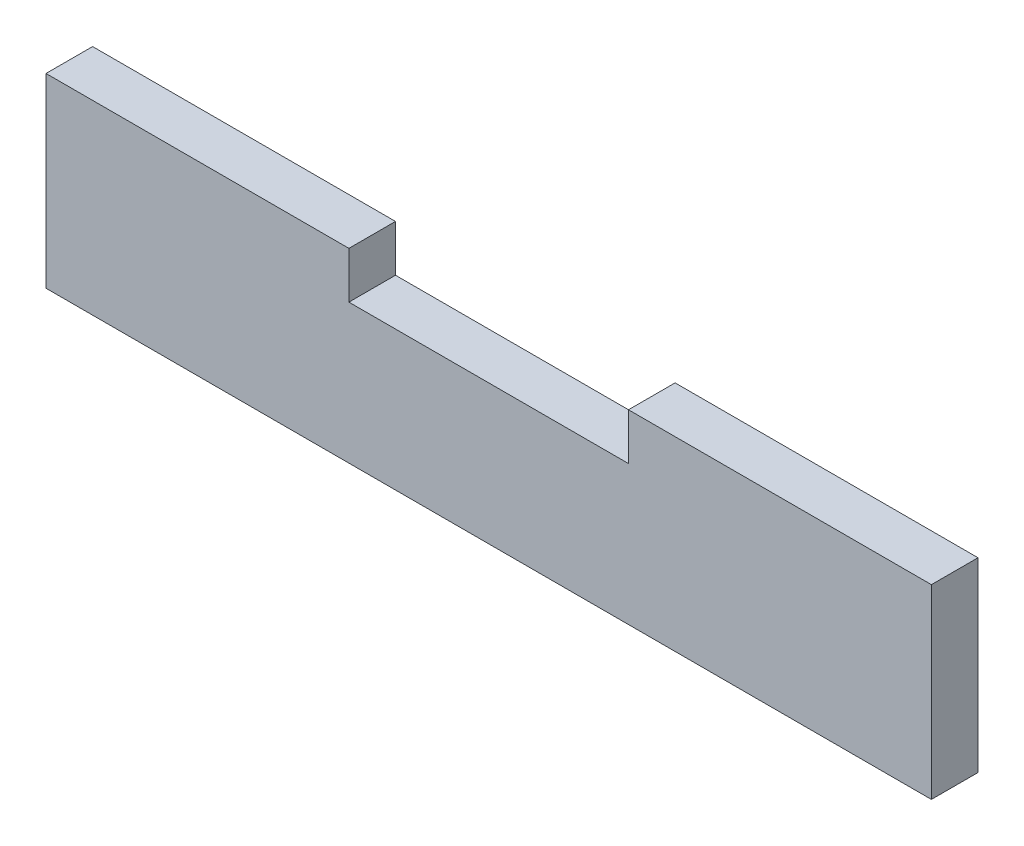
from build123d import *

# Parameters (mm, degrees)
BOSS_EXTRUDE1_DEPTH = 6.35


with BuildPart() as part:
    # Model → Boss-Extrude1 (new body)
    with BuildSketch(Plane.XY):
        Polygon((-19.05, 0), (19.05, 0), (19.05, 6.35), (60.325, 6.35), (60.325, -19), (-60.325, -19), (-60.325, 6.35), (-19.05, 6.35), align=None)
    extrude(amount=BOSS_EXTRUDE1_DEPTH)


solid = part.part
